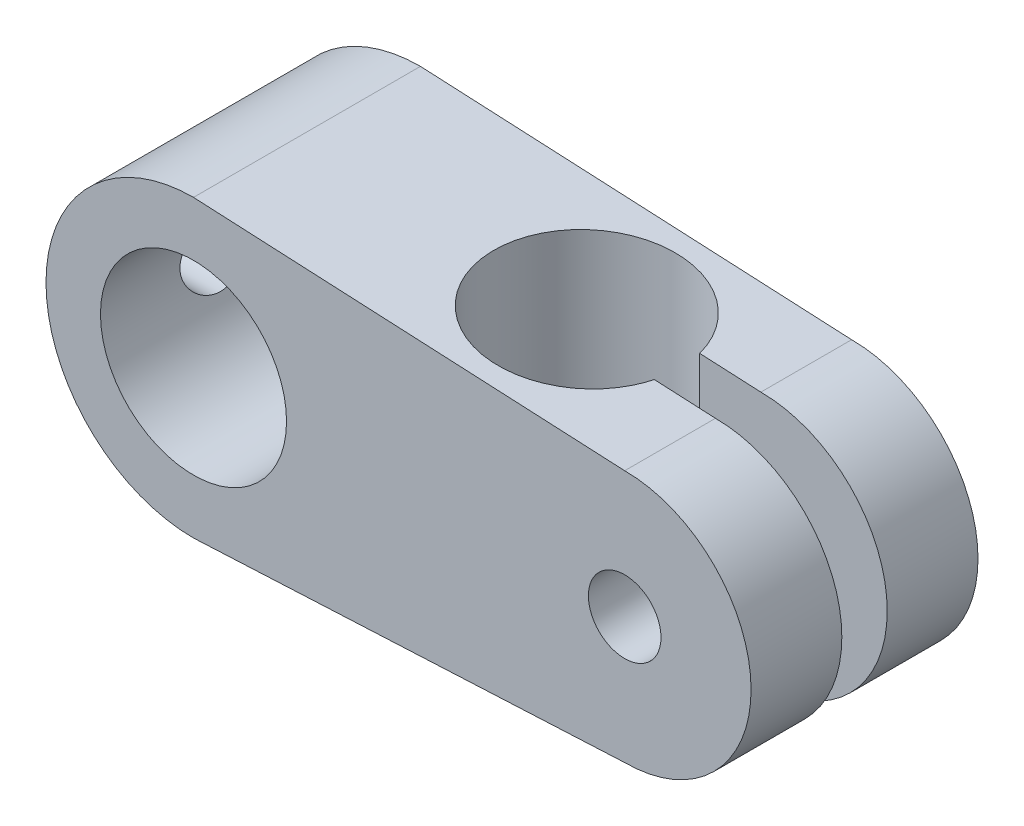
from build123d import *

# Parameters (mm, degrees)
SKETCH_1_R          = 4.1
EXTRUDE_1_DEPTH     = 10
SKETCH_6_R          = 4.1
CUT_EXTRUDE_2_DEPTH = 9.5
SKETCH_10_W         = 17.049616116
SKETCH_10_H         = 20.362574698
CUT_EXTRUDE_4_DEPTH = 1
SKETCH_11_R         = 1.6
CUT_EXTRUDE_5_DEPTH = 19.5
SKETCH_12_R         = 1.5
CUT_EXTRUDE_6_DEPTH = 39


with BuildPart() as part:
    # 草图1 → 凸台-拉伸1 (new body)
    with BuildSketch(Plane.XY):
        with BuildLine():
            Line((0.635580845, 6.468851288), (0, 6.5))
            ThreePointArc((0, 6.5), (-6.5, 0), (0, -6.5))
            Line((0, -6.5), (0.635580845, -6.468851288))
            Line((0.635580845, -6.468851288), (19, -5.568843046))
            ThreePointArc((19, -5.568843046), (24.568843046, 0), (19, 5.568843046))
            Line((19, 5.568843046), (0.635580845, 6.468851288))
        make_face()
        Circle(SKETCH_1_R, mode=Mode.SUBTRACT)
    extrude(amount=EXTRUDE_1_DEPTH)

    # 草图6 → 切除-拉伸2 (cut, symmetric)
    with BuildSketch(Plane(origin=(0, 0, 0), x_dir=(1, 0, 0), z_dir=(0, 1, 0))):
        with Locations((12.329939964, -5)):
            Circle(SKETCH_6_R)
    extrude(amount=CUT_EXTRUDE_2_DEPTH, both=True, mode=Mode.SUBTRACT)

    # 草图10 → 切除-拉伸4 (cut, symmetric)
    with BuildSketch(Plane.XY.offset(5)):
        with Locations((20.789235985, -0.838548644)):
            Rectangle(SKETCH_10_W, SKETCH_10_H)
    extrude(amount=CUT_EXTRUDE_4_DEPTH, both=True, mode=Mode.SUBTRACT)

    # 草图11 → 切除-拉伸5 (cut, symmetric)
    with BuildSketch(Plane.XY.offset(10)):
        with Locations((19, 0)):
            Circle(SKETCH_11_R)
    extrude(amount=CUT_EXTRUDE_5_DEPTH, both=True, mode=Mode.SUBTRACT)

    # 草图12 → 切除-拉伸6 (cut)
    with BuildSketch(Plane(origin=(0, 0, 0), x_dir=(0, 0, -1), z_dir=(1, 0, 0))):
        with Locations((-5, 0)):
            Circle(SKETCH_12_R)
    extrude(amount=-CUT_EXTRUDE_6_DEPTH, mode=Mode.SUBTRACT)


solid = part.part
